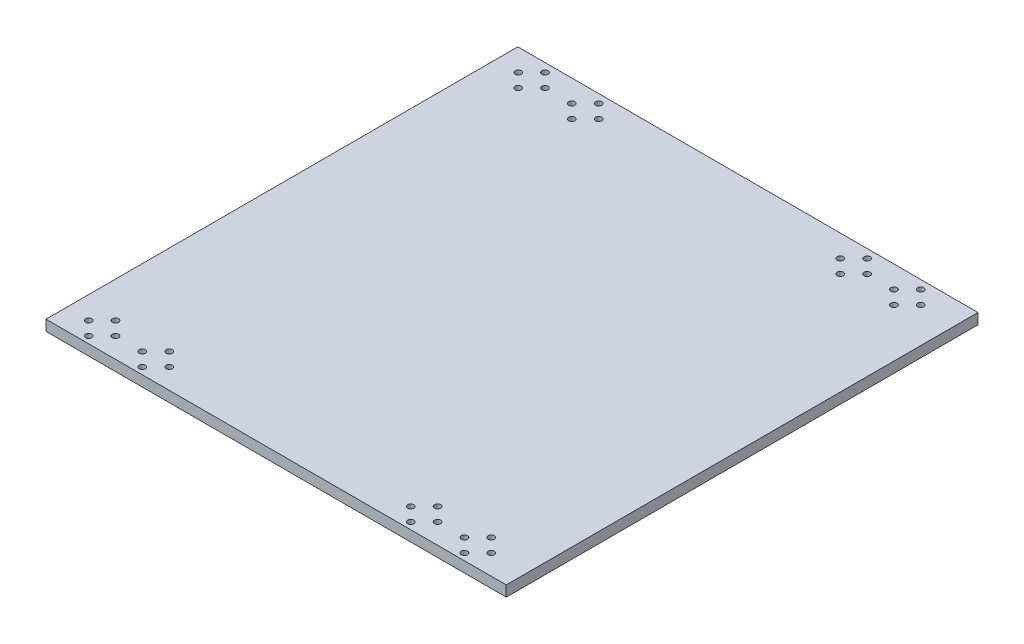
from build123d import *

# Parameters (mm, degrees)
SKETCH1_W           = 274.32
SKETCH1_H           = 288.036
BOSS_EXTRUDE1_DEPTH = 6.35
CUT_EXTRUDE1_REACH  = 243.958
SKETCH2_R           = 1.85
CUT_EXTRUDE2_REACH  = 243.958
SKETCH2_5_R         = 1.85
CUT_EXTRUDE3_REACH  = 243.958
SKETCH3_W           = 274.32
SKETCH3_H           = 3.146129422
SKETCH3_H_2         = 3.695646794


with BuildPart() as part:
    # Sketch1 → Boss-Extrude1 (new body)
    with BuildSketch(Plane(origin=(0, 0, 0), x_dir=(1, 0, 0), z_dir=(0, 1, 0))):
        with Locations((5.067487685, -51.620807882)):
            Rectangle(SKETCH1_W, SKETCH1_H)
    extrude(amount=BOSS_EXTRUDE1_DEPTH)

    # Sketch2 → Cut-Extrude1 (cut, up to next)
    with BuildSketch(Plane.XZ, mode=Mode.PRIVATE) as cut_extrude1_sk1:
        with Locations((-86.722512315, -75.542807004)):
            Circle(SKETCH2_R)
    cut_extrude1_tool1 = extrude(cut_extrude1_sk1.sketch, amount=-CUT_EXTRUDE1_REACH, mode=Mode.PRIVATE) & part.part
    # Sketch2 → Cut-Extrude1 (cut, up to next)
    with BuildSketch(Plane.XZ, mode=Mode.PRIVATE) as cut_extrude1_sk2:
        with Locations((-118.722512315, -75.542807004)):
            Circle(SKETCH2_R)
    cut_extrude1_tool2 = extrude(cut_extrude1_sk2.sketch, amount=-CUT_EXTRUDE1_REACH, mode=Mode.PRIVATE) & part.part
    # Sketch2 → Cut-Extrude1 (cut, up to next)
    with BuildSketch(Plane.XZ, mode=Mode.PRIVATE) as cut_extrude1_sk3:
        with Locations((-110.722512315, -83.542807004)):
            Circle(SKETCH2_R)
    cut_extrude1_tool3 = extrude(cut_extrude1_sk3.sketch, amount=-CUT_EXTRUDE1_REACH, mode=Mode.PRIVATE) & part.part
    # Sketch2 → Cut-Extrude1 (cut, up to next)
    with BuildSketch(Plane.XZ, mode=Mode.PRIVATE) as cut_extrude1_sk4:
        with Locations((-102.722512315, -75.542807004)):
            Circle(SKETCH2_R)
    cut_extrude1_tool4 = extrude(cut_extrude1_sk4.sketch, amount=-CUT_EXTRUDE1_REACH, mode=Mode.PRIVATE) & part.part
    # Sketch2 → Cut-Extrude1 (cut, up to next)
    with BuildSketch(Plane.XZ, mode=Mode.PRIVATE) as cut_extrude1_sk5:
        with Locations((-110.722512315, -67.542807004)):
            Circle(SKETCH2_R)
    cut_extrude1_tool5 = extrude(cut_extrude1_sk5.sketch, amount=-CUT_EXTRUDE1_REACH, mode=Mode.PRIVATE) & part.part
    # Sketch2 → Cut-Extrude1 (cut, up to next)
    with BuildSketch(Plane.XZ, mode=Mode.PRIVATE) as cut_extrude1_sk6:
        with Locations((-70.722512315, -75.542807004)):
            Circle(SKETCH2_R)
    cut_extrude1_tool6 = extrude(cut_extrude1_sk6.sketch, amount=-CUT_EXTRUDE1_REACH, mode=Mode.PRIVATE) & part.part
    # Sketch2 → Cut-Extrude1 (cut, up to next)
    with BuildSketch(Plane.XZ, mode=Mode.PRIVATE) as cut_extrude1_sk7:
        with Locations((-78.722512315, -67.542807004)):
            Circle(SKETCH2_R)
    cut_extrude1_tool7 = extrude(cut_extrude1_sk7.sketch, amount=-CUT_EXTRUDE1_REACH, mode=Mode.PRIVATE) & part.part
    # Sketch2 → Cut-Extrude1 (cut, up to next)
    with BuildSketch(Plane.XZ, mode=Mode.PRIVATE) as cut_extrude1_sk8:
        with Locations((-78.722512315, -83.542807004)):
            Circle(SKETCH2_R)
    cut_extrude1_tool8 = extrude(cut_extrude1_sk8.sketch, amount=-CUT_EXTRUDE1_REACH, mode=Mode.PRIVATE) & part.part
    add(cut_extrude1_tool1.solids().sort_by_distance((-86.722512, 0, -75.542807))[0], mode=Mode.SUBTRACT)
    add(cut_extrude1_tool2.solids().sort_by_distance((-118.722512, 0, -75.542807))[0], mode=Mode.SUBTRACT)
    add(cut_extrude1_tool3.solids().sort_by_distance((-110.722512, 0, -83.542807))[0], mode=Mode.SUBTRACT)
    add(cut_extrude1_tool4.solids().sort_by_distance((-102.722512, 0, -75.542807))[0], mode=Mode.SUBTRACT)
    add(cut_extrude1_tool5.solids().sort_by_distance((-110.722512, 0, -67.542807))[0], mode=Mode.SUBTRACT)
    add(cut_extrude1_tool6.solids().sort_by_distance((-70.722512, 0, -75.542807))[0], mode=Mode.SUBTRACT)
    add(cut_extrude1_tool7.solids().sort_by_distance((-78.722512, 0, -67.542807))[0], mode=Mode.SUBTRACT)
    add(cut_extrude1_tool8.solids().sort_by_distance((-78.722512, 0, -83.542807))[0], mode=Mode.SUBTRACT)

    # Sketch2<5> → Cut-Extrude2 (cut, up to next)
    with BuildSketch(Plane.XZ, mode=Mode.PRIVATE) as cut_extrude2_sk1:
        with Locations((121.277487685, -75.542807004)):
            Circle(SKETCH2_5_R)
    cut_extrude2_tool1 = extrude(cut_extrude2_sk1.sketch, amount=-CUT_EXTRUDE2_REACH, mode=Mode.PRIVATE) & part.part
    # Sketch2<5> → Cut-Extrude2 (cut, up to next)
    with BuildSketch(Plane.XZ, mode=Mode.PRIVATE) as cut_extrude2_sk2:
        with Locations((105.277487685, -75.542807004)):
            Circle(SKETCH2_5_R)
    cut_extrude2_tool2 = extrude(cut_extrude2_sk2.sketch, amount=-CUT_EXTRUDE2_REACH, mode=Mode.PRIVATE) & part.part
    # Sketch2<5> → Cut-Extrude2 (cut, up to next)
    with BuildSketch(Plane.XZ, mode=Mode.PRIVATE) as cut_extrude2_sk3:
        with Locations((113.277487685, -83.542807004)):
            Circle(SKETCH2_5_R)
    cut_extrude2_tool3 = extrude(cut_extrude2_sk3.sketch, amount=-CUT_EXTRUDE2_REACH, mode=Mode.PRIVATE) & part.part
    # Sketch2<5> → Cut-Extrude2 (cut, up to next)
    with BuildSketch(Plane.XZ, mode=Mode.PRIVATE) as cut_extrude2_sk4:
        with Locations((113.277487685, -67.542807004)):
            Circle(SKETCH2_5_R)
    cut_extrude2_tool4 = extrude(cut_extrude2_sk4.sketch, amount=-CUT_EXTRUDE2_REACH, mode=Mode.PRIVATE) & part.part
    # Sketch2<5> → Cut-Extrude2 (cut, up to next)
    with BuildSketch(Plane.XZ, mode=Mode.PRIVATE) as cut_extrude2_sk5:
        with Locations((89.277487685, -75.542807004)):
            Circle(SKETCH2_5_R)
    cut_extrude2_tool5 = extrude(cut_extrude2_sk5.sketch, amount=-CUT_EXTRUDE2_REACH, mode=Mode.PRIVATE) & part.part
    # Sketch2<5> → Cut-Extrude2 (cut, up to next)
    with BuildSketch(Plane.XZ, mode=Mode.PRIVATE) as cut_extrude2_sk6:
        with Locations((81.277487685, -83.542807004)):
            Circle(SKETCH2_5_R)
    cut_extrude2_tool6 = extrude(cut_extrude2_sk6.sketch, amount=-CUT_EXTRUDE2_REACH, mode=Mode.PRIVATE) & part.part
    # Sketch2<5> → Cut-Extrude2 (cut, up to next)
    with BuildSketch(Plane.XZ, mode=Mode.PRIVATE) as cut_extrude2_sk7:
        with Locations((81.277487685, -67.542807004)):
            Circle(SKETCH2_5_R)
    cut_extrude2_tool7 = extrude(cut_extrude2_sk7.sketch, amount=-CUT_EXTRUDE2_REACH, mode=Mode.PRIVATE) & part.part
    # Sketch2<5> → Cut-Extrude2 (cut, up to next)
    with BuildSketch(Plane.XZ, mode=Mode.PRIVATE) as cut_extrude2_sk8:
        with Locations((73.277487685, -75.542807004)):
            Circle(SKETCH2_5_R)
    cut_extrude2_tool8 = extrude(cut_extrude2_sk8.sketch, amount=-CUT_EXTRUDE2_REACH, mode=Mode.PRIVATE) & part.part
    # Sketch2<5> → Cut-Extrude2 (cut, up to next)
    with BuildSketch(Plane.XZ, mode=Mode.PRIVATE) as cut_extrude2_sk9:
        with Locations((73.277487685, 180.457192996)):
            Circle(SKETCH2_5_R)
    cut_extrude2_tool9 = extrude(cut_extrude2_sk9.sketch, amount=-CUT_EXTRUDE2_REACH, mode=Mode.PRIVATE) & part.part
    # Sketch2<5> → Cut-Extrude2 (cut, up to next)
    with BuildSketch(Plane.XZ, mode=Mode.PRIVATE) as cut_extrude2_sk10:
        with Locations((81.277487685, 188.457192996)):
            Circle(SKETCH2_5_R)
    cut_extrude2_tool10 = extrude(cut_extrude2_sk10.sketch, amount=-CUT_EXTRUDE2_REACH, mode=Mode.PRIVATE) & part.part
    # Sketch2<5> → Cut-Extrude2 (cut, up to next)
    with BuildSketch(Plane.XZ, mode=Mode.PRIVATE) as cut_extrude2_sk11:
        with Locations((81.277487685, 172.457192996)):
            Circle(SKETCH2_5_R)
    cut_extrude2_tool11 = extrude(cut_extrude2_sk11.sketch, amount=-CUT_EXTRUDE2_REACH, mode=Mode.PRIVATE) & part.part
    # Sketch2<5> → Cut-Extrude2 (cut, up to next)
    with BuildSketch(Plane.XZ, mode=Mode.PRIVATE) as cut_extrude2_sk12:
        with Locations((89.277487685, 180.457192996)):
            Circle(SKETCH2_5_R)
    cut_extrude2_tool12 = extrude(cut_extrude2_sk12.sketch, amount=-CUT_EXTRUDE2_REACH, mode=Mode.PRIVATE) & part.part
    # Sketch2<5> → Cut-Extrude2 (cut, up to next)
    with BuildSketch(Plane.XZ, mode=Mode.PRIVATE) as cut_extrude2_sk13:
        with Locations((105.277487685, 180.457192996)):
            Circle(SKETCH2_5_R)
    cut_extrude2_tool13 = extrude(cut_extrude2_sk13.sketch, amount=-CUT_EXTRUDE2_REACH, mode=Mode.PRIVATE) & part.part
    # Sketch2<5> → Cut-Extrude2 (cut, up to next)
    with BuildSketch(Plane.XZ, mode=Mode.PRIVATE) as cut_extrude2_sk14:
        with Locations((113.277487685, 188.457192996)):
            Circle(SKETCH2_5_R)
    cut_extrude2_tool14 = extrude(cut_extrude2_sk14.sketch, amount=-CUT_EXTRUDE2_REACH, mode=Mode.PRIVATE) & part.part
    # Sketch2<5> → Cut-Extrude2 (cut, up to next)
    with BuildSketch(Plane.XZ, mode=Mode.PRIVATE) as cut_extrude2_sk15:
        with Locations((121.277487685, 180.457192996)):
            Circle(SKETCH2_5_R)
    cut_extrude2_tool15 = extrude(cut_extrude2_sk15.sketch, amount=-CUT_EXTRUDE2_REACH, mode=Mode.PRIVATE) & part.part
    # Sketch2<5> → Cut-Extrude2 (cut, up to next)
    with BuildSketch(Plane.XZ, mode=Mode.PRIVATE) as cut_extrude2_sk16:
        with Locations((113.277487685, 172.457192996)):
            Circle(SKETCH2_5_R)
    cut_extrude2_tool16 = extrude(cut_extrude2_sk16.sketch, amount=-CUT_EXTRUDE2_REACH, mode=Mode.PRIVATE) & part.part
    # Sketch2<5> → Cut-Extrude2 (cut, up to next)
    with BuildSketch(Plane.XZ, mode=Mode.PRIVATE) as cut_extrude2_sk17:
        with Locations((-70.722512315, 180.457192996)):
            Circle(SKETCH2_5_R)
    cut_extrude2_tool17 = extrude(cut_extrude2_sk17.sketch, amount=-CUT_EXTRUDE2_REACH, mode=Mode.PRIVATE) & part.part
    # Sketch2<5> → Cut-Extrude2 (cut, up to next)
    with BuildSketch(Plane.XZ, mode=Mode.PRIVATE) as cut_extrude2_sk18:
        with Locations((-78.722512315, 188.457192996)):
            Circle(SKETCH2_5_R)
    cut_extrude2_tool18 = extrude(cut_extrude2_sk18.sketch, amount=-CUT_EXTRUDE2_REACH, mode=Mode.PRIVATE) & part.part
    # Sketch2<5> → Cut-Extrude2 (cut, up to next)
    with BuildSketch(Plane.XZ, mode=Mode.PRIVATE) as cut_extrude2_sk19:
        with Locations((-78.722512315, 172.457192996)):
            Circle(SKETCH2_5_R)
    cut_extrude2_tool19 = extrude(cut_extrude2_sk19.sketch, amount=-CUT_EXTRUDE2_REACH, mode=Mode.PRIVATE) & part.part
    # Sketch2<5> → Cut-Extrude2 (cut, up to next)
    with BuildSketch(Plane.XZ, mode=Mode.PRIVATE) as cut_extrude2_sk20:
        with Locations((-86.722512315, 180.457192996)):
            Circle(SKETCH2_5_R)
    cut_extrude2_tool20 = extrude(cut_extrude2_sk20.sketch, amount=-CUT_EXTRUDE2_REACH, mode=Mode.PRIVATE) & part.part
    # Sketch2<5> → Cut-Extrude2 (cut, up to next)
    with BuildSketch(Plane.XZ, mode=Mode.PRIVATE) as cut_extrude2_sk21:
        with Locations((-102.722512315, 180.457192996)):
            Circle(SKETCH2_5_R)
    cut_extrude2_tool21 = extrude(cut_extrude2_sk21.sketch, amount=-CUT_EXTRUDE2_REACH, mode=Mode.PRIVATE) & part.part
    # Sketch2<5> → Cut-Extrude2 (cut, up to next)
    with BuildSketch(Plane.XZ, mode=Mode.PRIVATE) as cut_extrude2_sk22:
        with Locations((-110.722512315, 188.457192996)):
            Circle(SKETCH2_5_R)
    cut_extrude2_tool22 = extrude(cut_extrude2_sk22.sketch, amount=-CUT_EXTRUDE2_REACH, mode=Mode.PRIVATE) & part.part
    # Sketch2<5> → Cut-Extrude2 (cut, up to next)
    with BuildSketch(Plane.XZ, mode=Mode.PRIVATE) as cut_extrude2_sk23:
        with Locations((-118.722512315, 180.457192996)):
            Circle(SKETCH2_5_R)
    cut_extrude2_tool23 = extrude(cut_extrude2_sk23.sketch, amount=-CUT_EXTRUDE2_REACH, mode=Mode.PRIVATE) & part.part
    # Sketch2<5> → Cut-Extrude2 (cut, up to next)
    with BuildSketch(Plane.XZ, mode=Mode.PRIVATE) as cut_extrude2_sk24:
        with Locations((-110.722512315, 172.457192996)):
            Circle(SKETCH2_5_R)
    cut_extrude2_tool24 = extrude(cut_extrude2_sk24.sketch, amount=-CUT_EXTRUDE2_REACH, mode=Mode.PRIVATE) & part.part
    add(cut_extrude2_tool1.solids().sort_by_distance((121.277488, 0, -75.542807))[0], mode=Mode.SUBTRACT)
    add(cut_extrude2_tool2.solids().sort_by_distance((105.277488, 0, -75.542807))[0], mode=Mode.SUBTRACT)
    add(cut_extrude2_tool3.solids().sort_by_distance((113.277488, 0, -83.542807))[0], mode=Mode.SUBTRACT)
    add(cut_extrude2_tool4.solids().sort_by_distance((113.277488, 0, -67.542807))[0], mode=Mode.SUBTRACT)
    add(cut_extrude2_tool5.solids().sort_by_distance((89.277488, 0, -75.542807))[0], mode=Mode.SUBTRACT)
    add(cut_extrude2_tool6.solids().sort_by_distance((81.277488, 0, -83.542807))[0], mode=Mode.SUBTRACT)
    add(cut_extrude2_tool7.solids().sort_by_distance((81.277488, 0, -67.542807))[0], mode=Mode.SUBTRACT)
    add(cut_extrude2_tool8.solids().sort_by_distance((73.277488, 0, -75.542807))[0], mode=Mode.SUBTRACT)
    add(cut_extrude2_tool9.solids().sort_by_distance((73.277488, 0, 180.457193))[0], mode=Mode.SUBTRACT)
    add(cut_extrude2_tool10.solids().sort_by_distance((81.277488, 0, 188.457193))[0], mode=Mode.SUBTRACT)
    add(cut_extrude2_tool11.solids().sort_by_distance((81.277488, 0, 172.457193))[0], mode=Mode.SUBTRACT)
    add(cut_extrude2_tool12.solids().sort_by_distance((89.277488, 0, 180.457193))[0], mode=Mode.SUBTRACT)
    add(cut_extrude2_tool13.solids().sort_by_distance((105.277488, 0, 180.457193))[0], mode=Mode.SUBTRACT)
    add(cut_extrude2_tool14.solids().sort_by_distance((113.277488, 0, 188.457193))[0], mode=Mode.SUBTRACT)
    add(cut_extrude2_tool15.solids().sort_by_distance((121.277488, 0, 180.457193))[0], mode=Mode.SUBTRACT)
    add(cut_extrude2_tool16.solids().sort_by_distance((113.277488, 0, 172.457193))[0], mode=Mode.SUBTRACT)
    add(cut_extrude2_tool17.solids().sort_by_distance((-70.722512, 0, 180.457193))[0], mode=Mode.SUBTRACT)
    add(cut_extrude2_tool18.solids().sort_by_distance((-78.722512, 0, 188.457193))[0], mode=Mode.SUBTRACT)
    add(cut_extrude2_tool19.solids().sort_by_distance((-78.722512, 0, 172.457193))[0], mode=Mode.SUBTRACT)
    add(cut_extrude2_tool20.solids().sort_by_distance((-86.722512, 0, 180.457193))[0], mode=Mode.SUBTRACT)
    add(cut_extrude2_tool21.solids().sort_by_distance((-102.722512, 0, 180.457193))[0], mode=Mode.SUBTRACT)
    add(cut_extrude2_tool22.solids().sort_by_distance((-110.722512, 0, 188.457193))[0], mode=Mode.SUBTRACT)
    add(cut_extrude2_tool23.solids().sort_by_distance((-118.722512, 0, 180.457193))[0], mode=Mode.SUBTRACT)
    add(cut_extrude2_tool24.solids().sort_by_distance((-110.722512, 0, 172.457193))[0], mode=Mode.SUBTRACT)

    # Sketch3 → Cut-Extrude3 (cut, up to next)
    with BuildSketch(Plane.XZ, mode=Mode.PRIVATE) as cut_extrude3_sk1:
        with Locations((5.067487685, 194.065743171)):
            Rectangle(SKETCH3_W, SKETCH3_H)
    cut_extrude3_tool1 = extrude(cut_extrude3_sk1.sketch, amount=-CUT_EXTRUDE3_REACH, mode=Mode.PRIVATE) & part.part
    # Sketch3 → Cut-Extrude3 (cut, up to next)
    with BuildSketch(Plane.XZ, mode=Mode.PRIVATE) as cut_extrude3_sk2:
        with Locations((5.067487685, -90.549368721)):
            Rectangle(SKETCH3_W, SKETCH3_H_2)
    cut_extrude3_tool2 = extrude(cut_extrude3_sk2.sketch, amount=-CUT_EXTRUDE3_REACH, mode=Mode.PRIVATE) & part.part
    add(cut_extrude3_tool1.solids().sort_by_distance((5.067488, 0, 194.065743))[0], mode=Mode.SUBTRACT)
    add(cut_extrude3_tool2.solids().sort_by_distance((5.067488, 0, -90.549369))[0], mode=Mode.SUBTRACT)


solid = part.part
